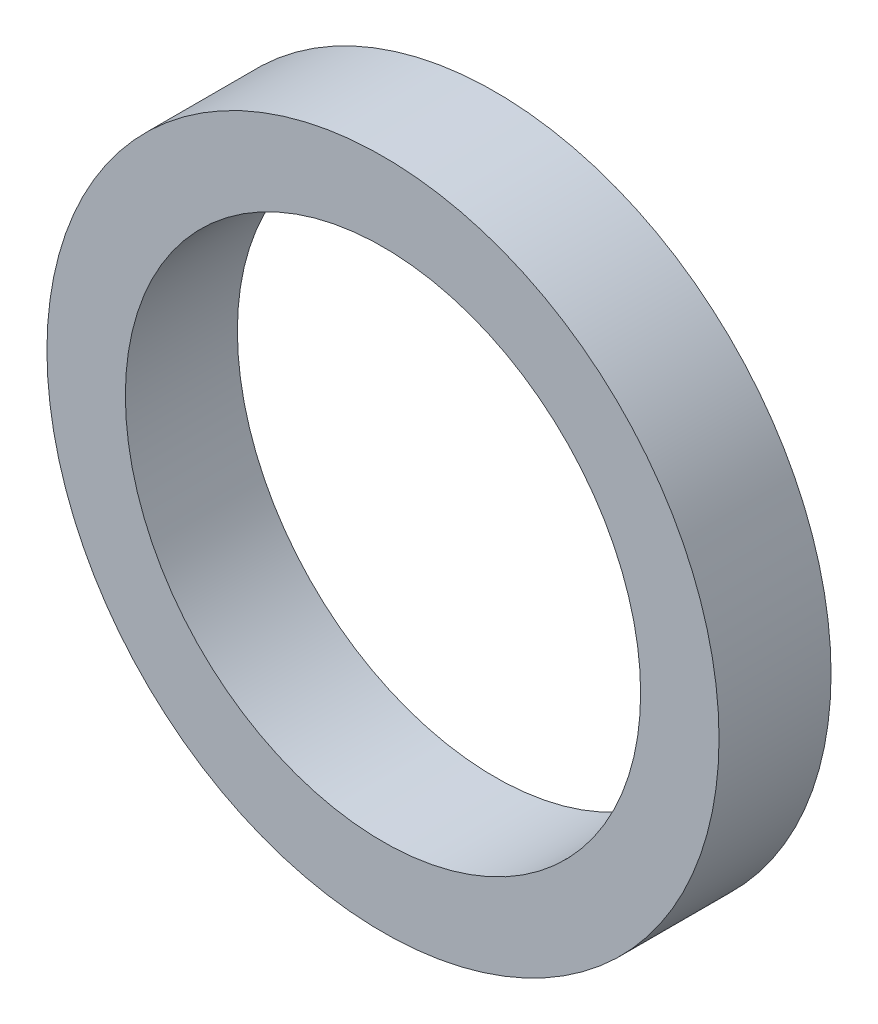
from build123d import *

# Parameters (mm, degrees)
ESQUISSE1_R        = 15
ESQUISSE1_R_2      = 11.5
BOSS_EXTRU_1_DEPTH = 5


with BuildPart() as part:
    # Esquisse1 → Boss.-Extru.1 (new body)
    with BuildSketch(Plane.XY):
        Circle(ESQUISSE1_R)
        Circle(ESQUISSE1_R_2, mode=Mode.SUBTRACT)
    extrude(amount=BOSS_EXTRU_1_DEPTH)


solid = part.part
